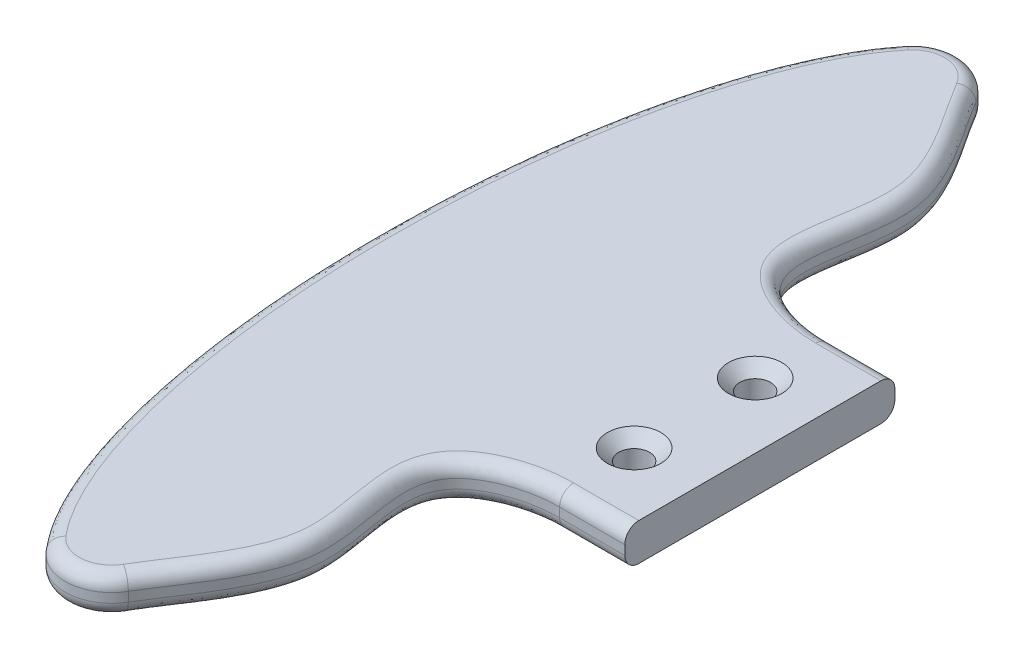
from build123d import *

# Parameters (mm, degrees)
BOSS_EXTRUDE1_DEPTH      = 4
CUT_EXTRUDE3_DEPTH       = 10
FILLET1_R                = 5
FILLET2_R                = 5
FILLET4_R                = 1.5
FILLET5_R                = 1.5
SKETCH8_R                = 1.65
M3_SCREWS_NO_ANGLE_DEPTH = 54.681326495


with BuildPart() as part:
    # Sketch1 → Boss-Extrude1 (new body)
    with BuildSketch(Plane(origin=(0, 0, 0), x_dir=(1, 0, 0), z_dir=(0, 1, 0))):
        with BuildLine():
            Line((16.747966294, -14.5), (23.747966294, -14.5))
            Line((23.747966294, -14.5), (23.747966294, 14.5))
            Line((23.747966294, 14.5), (16.747966294, 14.5))
            add(Edge.make_bspline(
                [(16.747966294, 14.5), (9.664328575, 81.290443783), (-10.191949143, 40.645221891), (-30.048226861, 0), (-10.191949143, -40.645221891), (9.664328575, -81.290443783), (16.747966294, -14.5)],
                knots=[1.865023165, 1.865023165, 1.865023165, 3.763267042, 3.763267042, 5.661510919, 5.661510919, 7.559754796, 7.559754796, 7.559754796], degree=2, weights=[1, 0.582397094, 1, 0.582397094, 1, 0.582397094, 1]))
        make_face()
    extrude(amount=BOSS_EXTRUDE1_DEPTH)

    # Sketch7 → Cut-Extrude3 (cut)
    with BuildSketch(Plane(origin=(0, 4, 0), x_dir=(1, 0, 0), z_dir=(0, 1, 0))):
        with BuildLine():
            add(Edge.make_bspline(
                [(35.83517019, 35.5), (30.150322813, 26.009483053), (25.324047473, 10.678611138), (3.540741799, 17.719370286), (12.871781876, 34.71868804), (-16.878774877, 59.680952108), (49.173546478, 54.38571705), (37.82177795, 38.816524324), (35.83517019, 35.5)],
                knots=[0, 0, 0, 0, 0.232924634, 0.310260479, 0.429154506, 0.587198804, 0.918602936, 1, 1, 1, 1], degree=3))
        make_face()
        with BuildLine():
            add(Edge.make_bspline(
                [(16.747966294, -14.5), (13.558567136, -14.455014265), (3.495828926, -17.754332607), (12.912081931, -34.688406497), (-17.06022516, -59.813608568), (50.54007293, -53.667392613), (29.791131794, -30.822291504), (26.134602306, -14.632396323), (16.747966294, -14.5)],
                knots=[0, 0, 0, 0, 0.077462686, 0.196551713, 0.354855224, 0.686802901, 0.772021625, 1, 1, 1, 1], degree=3))
        make_face()
    extrude(amount=-CUT_EXTRUDE3_DEPTH, mode=Mode.SUBTRACT)

    # Fillet1
    fillet1_edges = [part.edges().sort_by_distance(p)[0] for p in [
        (0, 2, -50),
    ]]
    fillet(fillet1_edges, radius=FILLET1_R)

    # Fillet2
    fillet2_edges = [part.edges().sort_by_distance(p)[0] for p in [
        (0, 2, 50),
    ]]
    fillet(fillet2_edges, radius=FILLET2_R)

    # Fillet4
    fillet4_edges = [part.edges().sort_by_distance(p)[0] for p in [
        (20.247966294, 4, -14.5),
        (7.84579636, 4, 27.61282303),
        (-17.499999645, 4, -0.010070684),
        (7.851066871, 4, -27.618196199),
        (-2.442344783, 4, -47.957918022),
        (-2.456759284, 4, 47.947252552),
        (20.247966294, 4, 14.5),
    ]]
    fillet(fillet4_edges, radius=FILLET4_R)

    # Fillet5
    fillet5_edges = [part.edges().sort_by_distance(p)[0] for p in [
        (7.845796372, 0, 27.61282308),
        (-17.499999645, 0, -0.010070684),
        (7.851066869, 0, -27.61819622),
        (-2.442344783, 0, -47.957918022),
        (-2.456759284, 0, 47.947252552),
        (20.247966294, 0, -14.5),
        (20.247966294, 0, 14.5),
    ]]
    fillet(fillet5_edges, radius=FILLET5_R)

    # Sketch8 → M3 Screws no Angle (cut, through all)
    with BuildSketch(Plane(origin=(0, 4, 0), x_dir=(1, 0, 0), z_dir=(0, 1, 0))):
        with Locations(Location((16.747966294, -6.5, 0), (0, 0, 270))):
            Circle(SKETCH8_R)
        with Locations(Location((16.747966294, 6.5, 0), (0, 0, 270))):
            Circle(SKETCH8_R)
    extrude(amount=-M3_SCREWS_NO_ANGLE_DEPTH, mode=Mode.SUBTRACT)

    # M3 Head cone 1 section (through the dimple's axis) → M3 Head (revolve, cut)
    with BuildSketch(Plane(origin=(16.747966294, 4, -6.5), x_dir=(0, 0, 1), z_dir=(1, 0, 0))):
        Polygon((0, 0), (2.875, 0), (0, 2.875), align=None)
    revolve(axis=Axis((16.747966294, 4, -6.5), (0, -1, 0)), mode=Mode.SUBTRACT)

    # M3 Head cone 2 section (through the dimple's axis) → M3 Head cone 2 (revolve, cut)
    with BuildSketch(Plane(origin=(16.747966294, 4, 6.5), x_dir=(0, 0, 1), z_dir=(1, 0, 0))):
        Polygon((0, 0), (2.875, 0), (0, 2.875), align=None)
    revolve(axis=Axis((16.747966294, 4, 6.5), (0, -1, 0)), mode=Mode.SUBTRACT)


solid = part.part
